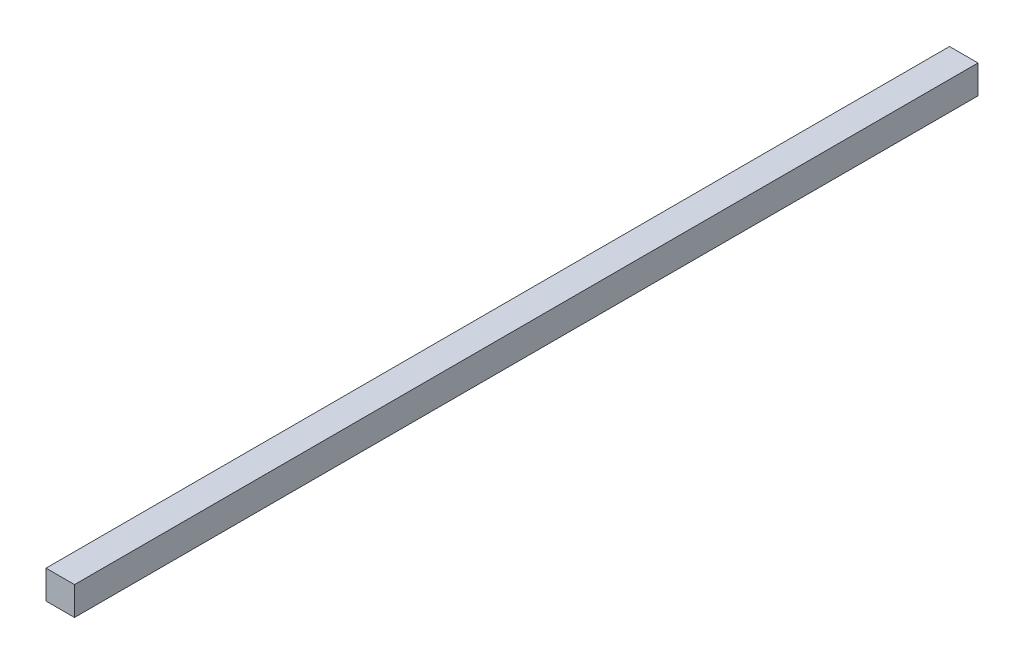
from build123d import *

# Parameters (mm, degrees)
SKETCH1_W      = 25.4
SKETCH1_H      = 25.4
EXTRUDE1_DEPTH = 805.18


with BuildPart() as part:
    # Sketch1 → Extrude1 (new body)
    with BuildSketch(Plane.XY):
        with Locations((78.374005341, 38.1)):
            Rectangle(SKETCH1_W, SKETCH1_H)
    extrude(amount=EXTRUDE1_DEPTH)


solid = part.part
